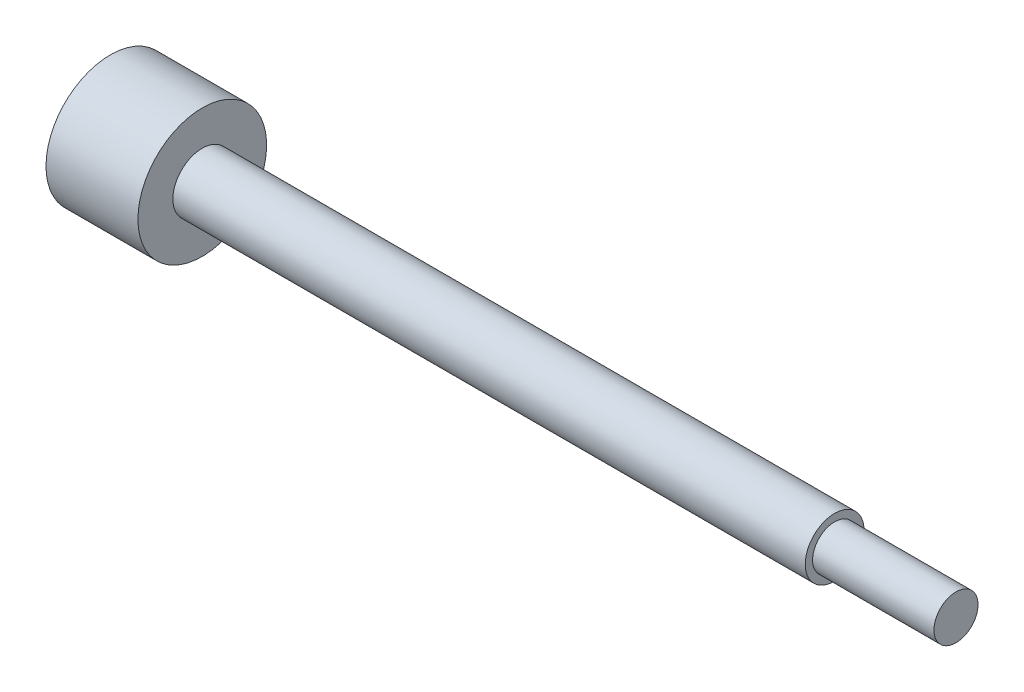
from build123d import *


with BuildPart() as part:
    # 草图2 → 旋转1 (revolve)
    with BuildSketch(Plane.XY, mode=Mode.PRIVATE) as revolve_1_sk:
        Polygon((0, 0), (0, 17.5), (25, 17.5), (25, 8), (197, 8), (197, 6), (230, 6), (230, 0), align=None)
    revolve(revolve_1_sk.sketch.rotate(Axis((0, 0, 0), (1, 0, 0)), 90), axis=Axis((0, 0, 0), (1, 0, 0)))


solid = part.part
